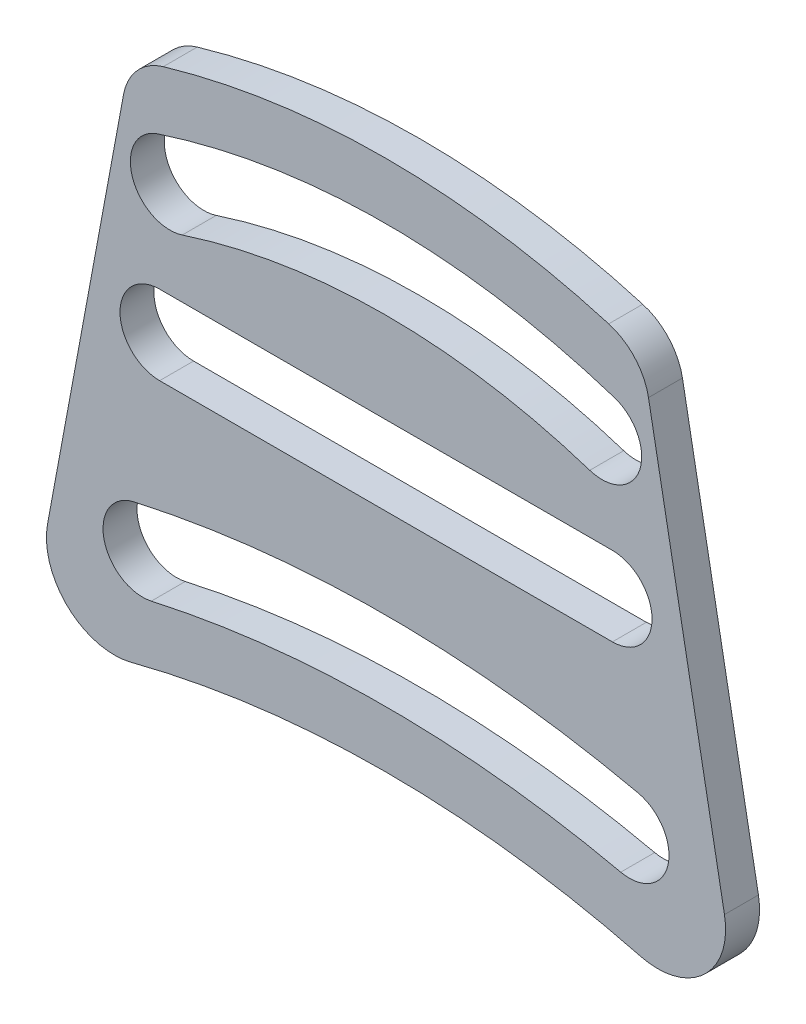
from build123d import *

# Parameters (mm, degrees)
BOSS_EXTRUDE4_DEPTH = 3


with BuildPart() as part:
    # Sketch1 → Boss-Extrude4 (new body)
    with BuildSketch(Plane.XY):
        with BuildLine():
            Line((-29.899423372, -36.934875117), (-23.187084604, -0.737928439))
            ThreePointArc((-23.187084604, -0.737928439), (-21.98135558, 1.701910522), (-19.676352188, 3.148823096))
            ThreePointArc((-19.676352188, 3.148823096), (0, 5.971139565), (19.676352188, 3.148823096))
            ThreePointArc((19.676352188, 3.148823096), (21.98135558, 1.701910522), (23.187084604, -0.737928439))
            Line((23.187084604, -0.737928439), (29.899423372, -36.934875117))
            ThreePointArc((29.899423372, -36.934875117), (28.093063969, -42.415981056), (22.5, -43.838335454))
            ThreePointArc((22.5, -43.838335454), (0, -40.980460744), (-22.5, -43.838335454))
            ThreePointArc((-22.5, -43.838335454), (-28.093063969, -42.415981056), (-29.899423372, -36.934875117))
        make_face()
        with BuildLine():
            Line((-19.999993368, -14.036878488), (20.000003419, -14.020845591))
            ThreePointArc((20.000003419, -14.020845591), (23.500003419, -17.520845591), (20.000003419, -21.020845591))
            Line((20.000003419, -21.020845591), (-19.999993368, -21.036878488))
            ThreePointArc((-19.999993368, -21.036878488), (-23.499993368, -17.536878488), (-19.999993368, -14.036878488))
        make_face(mode=Mode.SUBTRACT)
        with BuildLine():
            ThreePointArc((20.172628238, -2.238367072), (0, 0.971139565), (-20.172628238, -2.238367072))
            ThreePointArc((-20.172628238, -2.238367072), (-22.413590206, -6.651765928), (-18.000191351, -8.892727896))
            ThreePointArc((-18.000191351, -8.892727896), (0, -6.028860435), (18.000191351, -8.892727896))
            ThreePointArc((18.000191351, -8.892727896), (22.413590206, -6.651765928), (20.172628238, -2.238367072))
        make_face(mode=Mode.SUBTRACT)
        with BuildLine():
            ThreePointArc((22.263959391, -31.439935769), (0, -28.980460744), (-22.263959391, -31.439935769))
            ThreePointArc((-22.263959391, -31.439935769), (-24.915606249, -35.619501409), (-20.736040609, -38.271148267))
            ThreePointArc((-20.736040609, -38.271148267), (0, -35.980460744), (20.736040609, -38.271148267))
            ThreePointArc((20.736040609, -38.271148267), (24.915606249, -35.619501409), (22.263959391, -31.439935769))
        make_face(mode=Mode.SUBTRACT)
    extrude(amount=BOSS_EXTRUDE4_DEPTH)


solid = part.part
